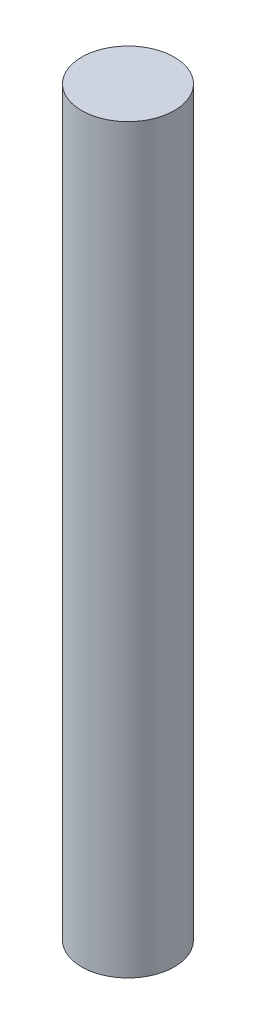
from build123d import *

# Parameters (mm, degrees)
SKETCH_1_R      = 2.5
EXTRUDE_1_DEPTH = 20


with BuildPart() as part:
    # 草图1 → 凸台-拉伸1 (new, symmetric)
    with BuildSketch(Plane(origin=(0, 0, 0), x_dir=(1, 0, 0), z_dir=(0, 1, 0))):
        with Locations(Location((0, 0, 0), (0, 0, 270))):
            Circle(SKETCH_1_R)
    extrude(amount=EXTRUDE_1_DEPTH, both=True)


solid = part.part
